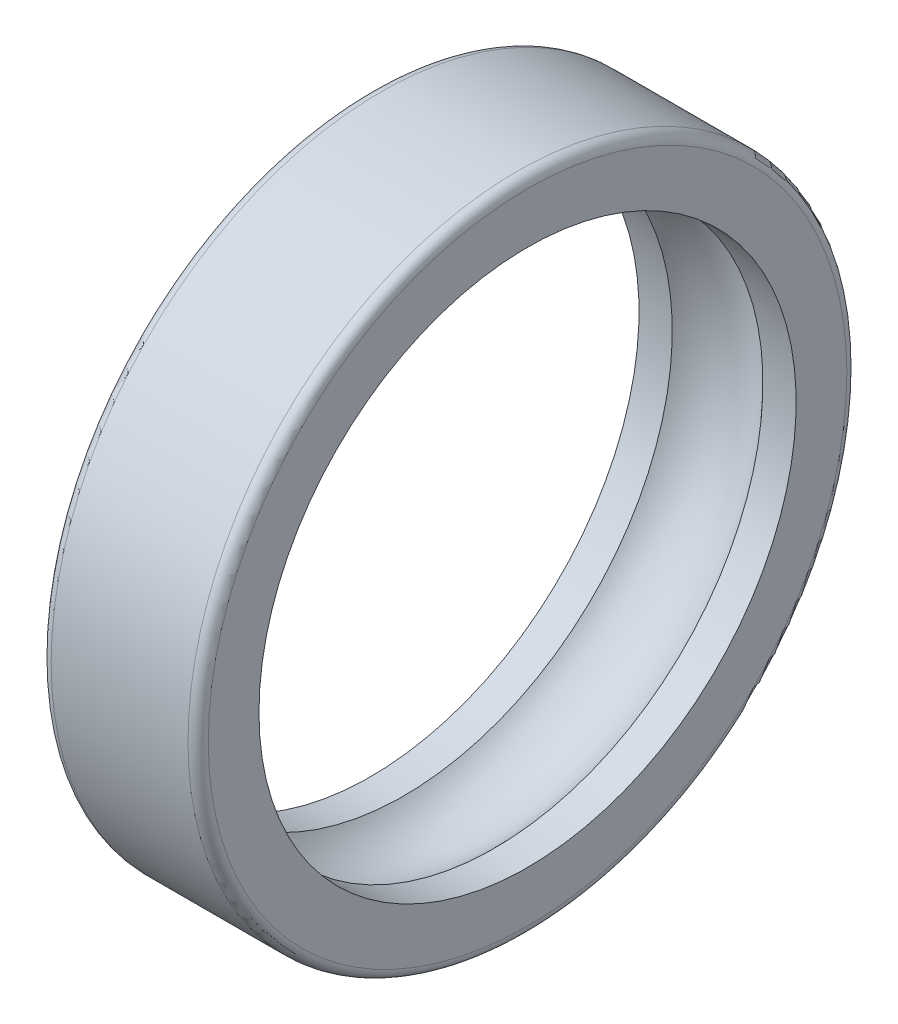
from build123d import *

# Parameters (mm, degrees)
FILLET_1_R = 2


with BuildPart() as part:
    # 草图1 → 旋转1 (revolve)
    with BuildSketch(Plane.XY, mode=Mode.PRIVATE) as revolve_1_sk:
        with BuildLine():
            Line((8.94427191, 53), (15.5, 53))
            Line((15.5, 53), (15.5, 65))
            Line((15.5, 65), (-15.5, 65))
            Line((-15.5, 65), (-15.5, 53))
            Line((-15.5, 53), (-8.94427191, 53))
            ThreePointArc((-8.94427191, 53), (0, 57), (8.94427191, 53))
        make_face()
    revolve(revolve_1_sk.sketch.rotate(Axis((0, 0, 0), (1, 0, 0)), 90), axis=Axis((0, 0, 0), (1, 0, 0)))

    # 圆角1
    fillet_1_edges = [part.edges().sort_by_distance(p)[0] for p in [
        (15.5, 0, -65),
        (-15.5, 0, -65),
    ]]
    fillet(fillet_1_edges, radius=FILLET_1_R)


solid = part.part
